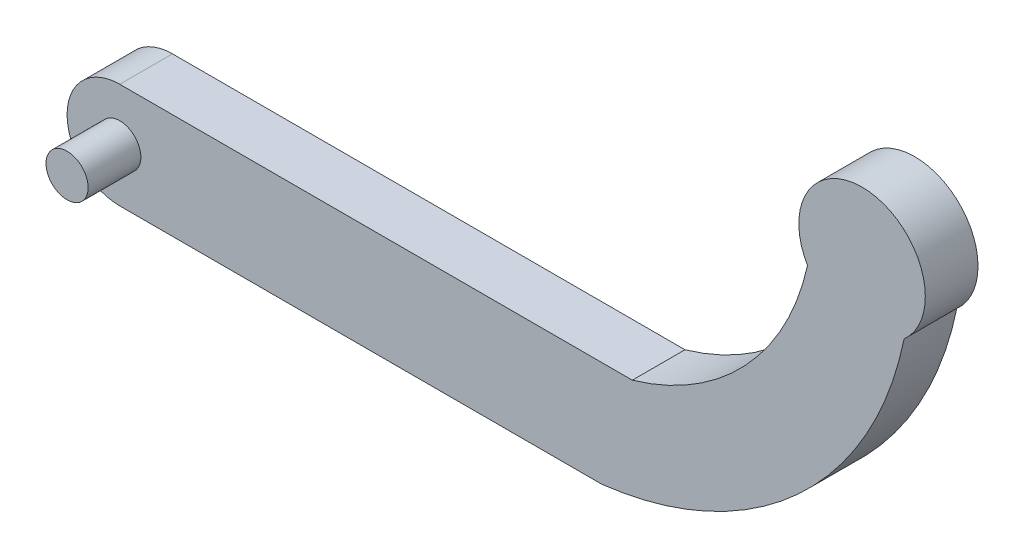
from build123d import *

# Parameters (mm, degrees)
SALIENTE_EXTRUIR1_DEPTH = 5
CROQUIS2_R              = 2
SALIENTE_EXTRUIR2_DEPTH = 10


with BuildPart() as part:
    # Croquis1 → Saliente-Extruir1 (new body)
    with BuildSketch(Plane.XY):
        with BuildLine():
            Line((5.788348274, -6.740393182), (-39.936853781, -6.740393182))
            ThreePointArc((-39.936853781, -6.740393182), (-44.936853781, -1.740393182), (-39.936853781, 3.259606818))
            Line((-39.936853781, 3.259606818), (8.694861452, 3.259606818))
            ThreePointArc((8.694861452, 3.259606818), (19.436497165, 9.850973357), (25.319941104, 20.996104045))
            ThreePointArc((25.319941104, 20.996104045), (31.436981506, 29.954437164), (34.482454636, 19.543144787))
            ThreePointArc((34.482454636, 19.543144787), (24.402815118, 1.742580565), (5.788348274, -6.740393182))
        make_face()
    extrude(amount=SALIENTE_EXTRUIR1_DEPTH)

    # Croquis2 → Saliente-Extruir2 (add)
    with BuildSketch(Plane(origin=(0, 0, 0), x_dir=(-1, 0, 0), z_dir=(0, 0, -1))):
        with Locations((39.936853781, -1.740393182)):
            Circle(CROQUIS2_R)
    extrude(amount=-SALIENTE_EXTRUIR2_DEPTH)


solid = part.part
